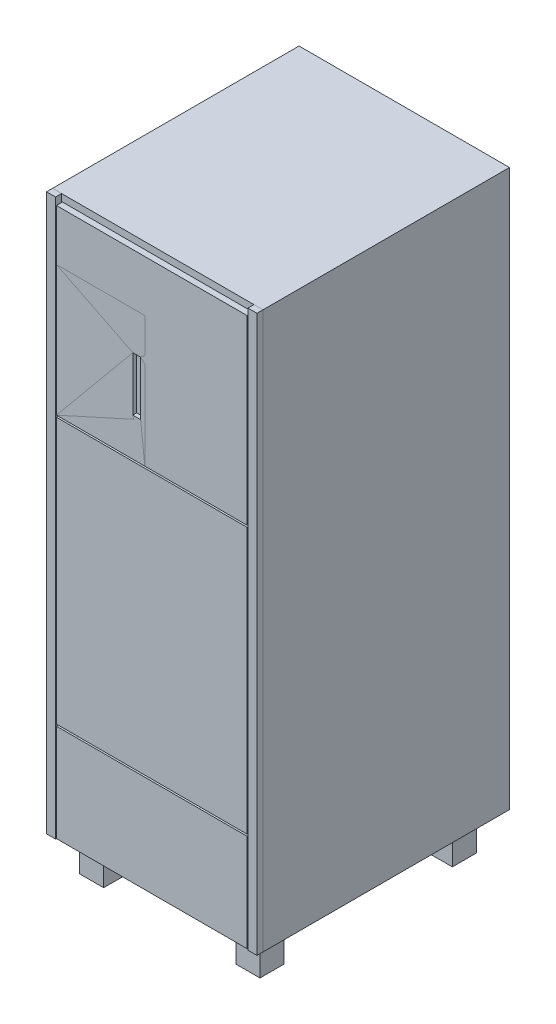
from build123d import *

# Parameters (mm, degrees)
SKETCH1_W                 = 700
SKETCH1_H                 = 1850
GOVDE_KASA_DEPTH          = 820
SKETCH2_W                 = 80
SKETCH2_H                 = 80
AYAK_1_DEPTH              = 120
SKETCH3_W                 = 80
SKETCH3_H                 = 80
AYAK_2_DEPTH              = 120
SKETCH4_W                 = 80
SKETCH4_H                 = 80
AYAK_3_DEPTH              = 120
SKETCH5_W                 = 80
SKETCH5_H                 = 80
AYAK_4_DEPTH              = 120
SKETCH6_W                 = 30
SKETCH6_H                 = 1850
SOVE_SOL_DEPTH            = 20
SKETCH7_W                 = 30
SKETCH7_H                 = 1850
SOVE_SAG_DEPTH            = 20
SKETCH8_W                 = 634
SKETCH8_H                 = 604
PANEL_UST_DEPTH           = 20
SKETCH9_W                 = 294
SKETCH9_H                 = 434
KAPAK_PANO_UST_DEPTH      = 20
KAPAK_PANO_UST_KULP_START = 7
SKETCH10_W                = 26
SKETCH10_H                = 180
KAPAK_PANO_UST_KULP_DEPTH = 13
SKETCH11_W                = 634
SKETCH11_H                = 884
PANEL_ORTA_DEPTH          = 20
SKETCH12_W                = 494
SKETCH12_H                = 354
ACIKLIK_TEPSI_DEPTH       = 100
SKETCH13_W                = 634
SKETCH13_H                = 324
PANEL_ALT_DEPTH           = 20


with BuildPart() as part:
    # Sketch1 → govde_kasa (new body)
    with BuildSketch(Plane.XY):
        with Locations((350, 1045)):
            Rectangle(SKETCH1_W, SKETCH1_H)
    extrude(amount=-GOVDE_KASA_DEPTH)

    # Sketch12 → aciklik_tepsi (cut)
    with BuildSketch(Plane.XY):
        with Locations((350, 900)):
            Rectangle(SKETCH12_W, SKETCH12_H)
    extrude(amount=-ACIKLIK_TEPSI_DEPTH, mode=Mode.SUBTRACT)


with BuildPart() as body_2:
    # Sketch2 → ayak_1 (new body)
    with BuildSketch(Plane(origin=(0, 0, 0), x_dir=(1, 0, 0), z_dir=(0, 1, 0))):
        with Locations((90, 80)):
            Rectangle(SKETCH2_W, SKETCH2_H)
    extrude(amount=AYAK_1_DEPTH)


with BuildPart() as body_3:
    # Sketch3 → ayak_2 (new body)
    with BuildSketch(Plane(origin=(0, 0, 0), x_dir=(1, 0, 0), z_dir=(0, 1, 0))):
        with Locations((610, 80)):
            Rectangle(SKETCH3_W, SKETCH3_H)
    extrude(amount=AYAK_2_DEPTH)


with BuildPart() as body_4:
    # Sketch4 → ayak_3 (new body)
    with BuildSketch(Plane(origin=(0, 0, 0), x_dir=(1, 0, 0), z_dir=(0, 1, 0))):
        with Locations((90, 720)):
            Rectangle(SKETCH4_W, SKETCH4_H)
    extrude(amount=AYAK_3_DEPTH)


with BuildPart() as body_5:
    # Sketch5 → ayak_4 (new body)
    with BuildSketch(Plane(origin=(0, 0, 0), x_dir=(1, 0, 0), z_dir=(0, 1, 0))):
        with Locations((610, 720)):
            Rectangle(SKETCH5_W, SKETCH5_H)
    extrude(amount=AYAK_4_DEPTH)


with BuildPart() as body_6:
    # Sketch6 → sove_sol (new body)
    with BuildSketch(Plane.XY):
        with Locations((15, 1045)):
            Rectangle(SKETCH6_W, SKETCH6_H)
    extrude(amount=SOVE_SOL_DEPTH)


with BuildPart() as body_7:
    # Sketch7 → sove_sag (new body)
    with BuildSketch(Plane.XY):
        with Locations((685, 1045)):
            Rectangle(SKETCH7_W, SKETCH7_H)
    extrude(amount=SOVE_SAG_DEPTH)


with BuildPart() as body_8:
    # Sketch8 → panel_ust (new body)
    with BuildSketch(Plane.XY):
        with Locations((350, 1645)):
            Rectangle(SKETCH8_W, SKETCH8_H)
    extrude(amount=PANEL_UST_DEPTH)


with BuildPart() as body_9:
    # Sketch9 → kapak_pano_ust (new body)
    with BuildSketch(Plane.XY):
        with Locations((180, 1560)):
            Rectangle(SKETCH9_W, SKETCH9_H)
    extrude(amount=KAPAK_PANO_UST_DEPTH)


with BuildPart() as kapak_pano_ust_kulp_tool:
    # Sketch10 → kapak_pano_ust_kulp (new body)
    with BuildSketch(Plane.XY.offset(KAPAK_PANO_UST_KULP_START)):
        with Locations((300, 1560)):
            Rectangle(SKETCH10_W, SKETCH10_H)
    extrude(amount=KAPAK_PANO_UST_KULP_DEPTH)


with BuildPart() as body_8_1:
    add(body_8.part)

    # kapak_pano_ust_kulp: cut by kapak_pano_ust_kulp_tool
    add(kapak_pano_ust_kulp_tool.part, mode=Mode.SUBTRACT)


with BuildPart() as body_9_1:
    add(body_9.part)

    # kapak_pano_ust_kulp: cut by kapak_pano_ust_kulp_tool
    add(kapak_pano_ust_kulp_tool.part, mode=Mode.SUBTRACT)


with BuildPart() as body_10:
    # Sketch11 → panel_orta (new body)
    with BuildSketch(Plane.XY):
        with Locations((350, 895)):
            Rectangle(SKETCH11_W, SKETCH11_H)
    extrude(amount=PANEL_ORTA_DEPTH)


with BuildPart() as body_11:
    # Sketch13 → panel_alt (new body)
    with BuildSketch(Plane.XY):
        with Locations((350, 285)):
            Rectangle(SKETCH13_W, SKETCH13_H)
    extrude(amount=PANEL_ALT_DEPTH)


solid = Compound([part.part, body_2.part, body_3.part, body_4.part, body_5.part, body_6.part, body_7.part, body_8_1.part, body_9_1.part, body_10.part, body_11.part])
